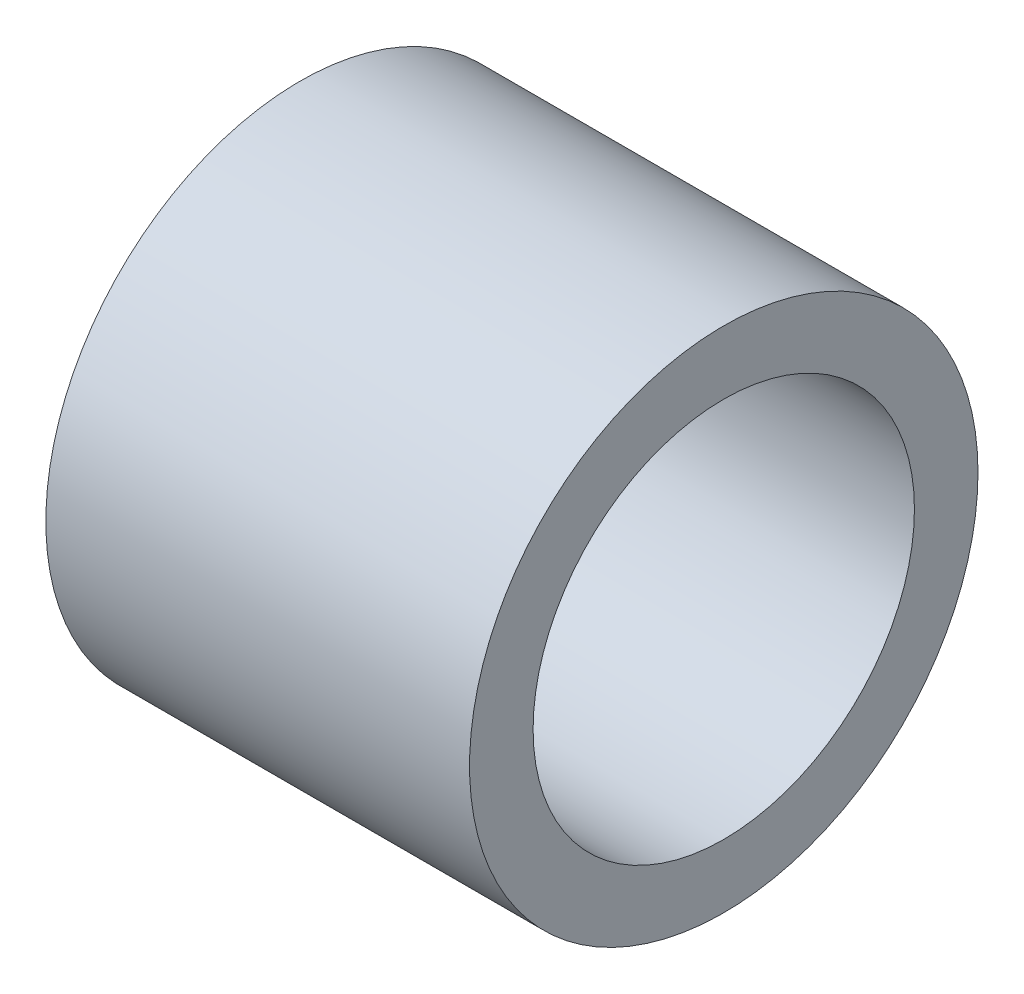
from build123d import *

# Parameters (mm, degrees)
SKETCH1_R           = 3
SKETCH1_R_2         = 2.25
BOSS_EXTRUDE1_DEPTH = 2.5


with BuildPart() as part:
    # Sketch1 → Boss-Extrude1 (new, symmetric)
    with BuildSketch(Plane(origin=(0, 0, 0), x_dir=(0, 0, -1), z_dir=(1, 0, 0))):
        Circle(SKETCH1_R)
        Circle(SKETCH1_R_2, mode=Mode.SUBTRACT)
    extrude(amount=BOSS_EXTRUDE1_DEPTH, both=True)


solid = part.part
